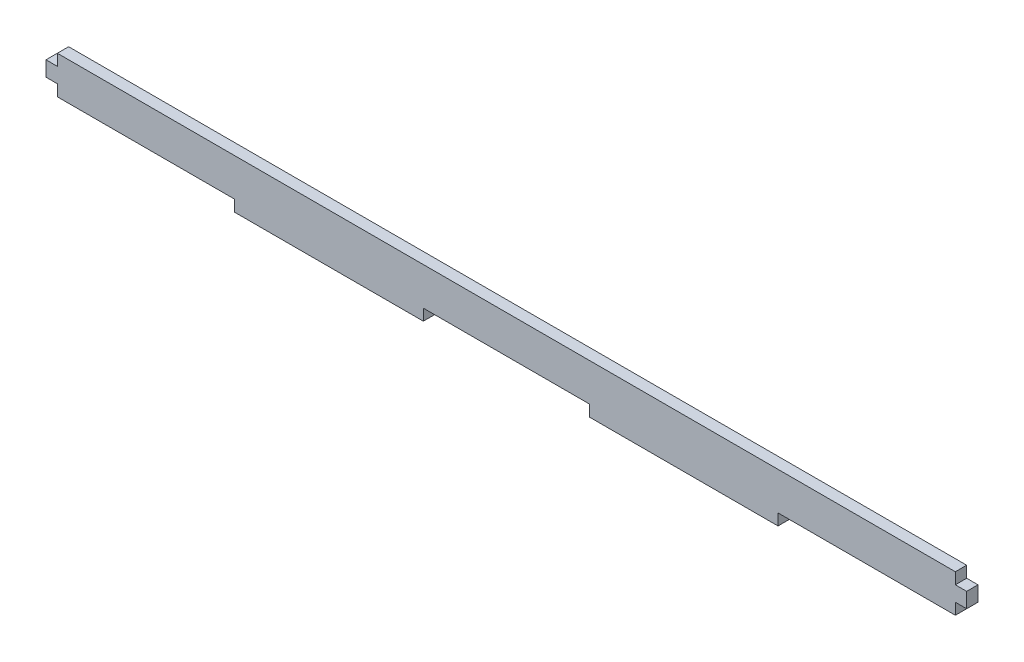
from build123d import *

# Parameters (mm, degrees)
BOSS_EXTRUDE1_DEPTH = 3


with BuildPart() as part:
    # Sketch1 → Boss-Extrude1 (new body)
    with BuildSketch(Plane.XY):
        Polygon((97, 0), (141, 0), (141, -3), (191, -3), (191, 0), (238, 0), (238, 3), (241, 3), (241, 7), (238, 7), (238, 10), (0, 10), (0, 7), (-3, 7), (-3, 3), (0, 3), (0, 0), (47, 0), (47, -3), (97, -3), align=None)
    extrude(amount=BOSS_EXTRUDE1_DEPTH)


solid = part.part
